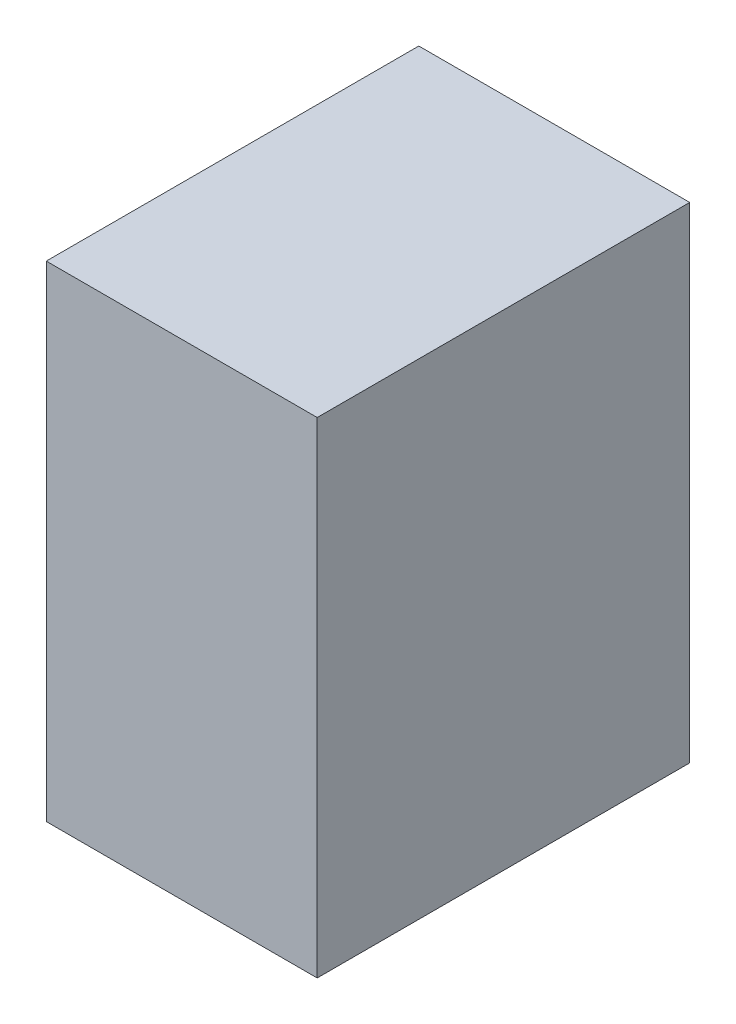
from build123d import *

# Parameters (mm, degrees)
CASE_SKETCH_W = 33
CASE_SKETCH_H = 43
CASE_2_DEPTH  = 24


with BuildPart() as part:
    # Case Sketch → Case 2 (new body)
    with BuildSketch(Plane(origin=(0, 0, 0), x_dir=(0, 0, -1), z_dir=(1, 0, 0))):
        with Locations((-62, -20)):
            Rectangle(CASE_SKETCH_W, CASE_SKETCH_H)
    extrude(amount=-CASE_2_DEPTH)


solid = part.part
